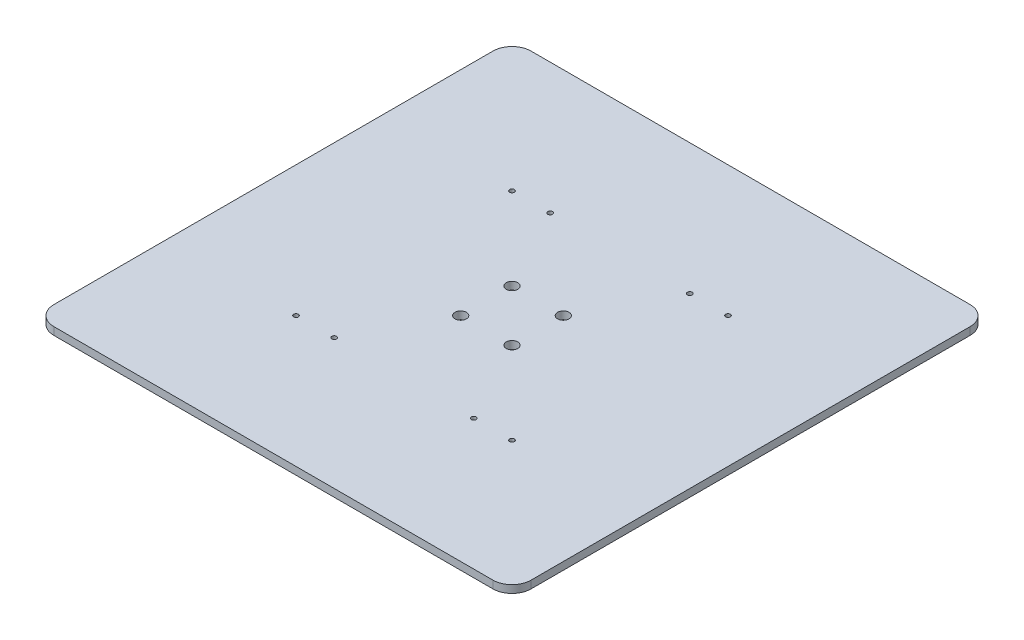
from build123d import *

# Parameters (mm, degrees)
SKETCH_1_W               = 250
SKETCH_1_H               = 250
EXTRUDE_1_DEPTH          = 4
FILLET_1_R               = 10
SKETCH_3_R               = 1.25
CUT_EXTRUDE_4_DEPTH      = 177.821944339
PATTERN_CIRCULAR_2_COUNT = 4
SKETCH_7_R               = 1.25
CUT_EXTRUDE_11_DEPTH     = 10
SKETCH_9_R               = 3
CUT_EXTRUDE_12_DEPTH     = 10


with BuildPart() as part:
    # 草图1 → 凸台-拉伸1 (new body)
    with BuildSketch(Plane(origin=(0, 0, 0), x_dir=(1, 0, 0), z_dir=(0, 1, 0))):
        Rectangle(SKETCH_1_W, SKETCH_1_H)
    extrude(amount=EXTRUDE_1_DEPTH)

    # 圆角1
    fillet_1_edges = [part.edges().sort_by_distance(p)[0] for p in [
        (125, 2, 125),
        (-125, 2, 125),
        (-125, 2, -125),
        (125, 2, -125),
    ]]
    fillet(fillet_1_edges, radius=FILLET_1_R)

    # 草图3 → 切除-拉伸4 (cut, through all)
    with BuildSketch(Plane.XZ):
        with Locations(Location((56.568542495, 56.568542495, 0), (0, 0, 270))):
            Circle(SKETCH_3_R)
    cut_extrude_4 = extrude(amount=-CUT_EXTRUDE_4_DEPTH, mode=Mode.SUBTRACT)

    # 阵列(圆周)2: 切除-拉伸4 ×4 about axis
    pattern_circular_2_axis = Axis((-0.004449343, 0, -0.004449343), (0, 1, 0))
    for i in range(1, PATTERN_CIRCULAR_2_COUNT):
        add(cut_extrude_4.rotate(pattern_circular_2_axis, i * 360 / PATTERN_CIRCULAR_2_COUNT), mode=Mode.SUBTRACT)

    # 草图7 → 切除-拉伸11 (cut)
    with BuildSketch(Plane.XZ):
        with Locations(Location((-36.577441182, -56.577441182, 0), (0, 0, 270))):
            Circle(SKETCH_7_R)
        with Locations(Location((36.568542495, -56.577441182, 0), (0, 0, 270))):
            Circle(SKETCH_7_R)
        with Locations(Location((-36.577441182, 56.568542495, 0), (0, 0, 270))):
            Circle(SKETCH_7_R)
        with Locations(Location((36.568542495, 56.568542495, 0), (0, 0, 270))):
            Circle(SKETCH_7_R)
    extrude(amount=-CUT_EXTRUDE_11_DEPTH, mode=Mode.SUBTRACT)

    # 草图9 → 切除-拉伸12 (cut)
    with BuildSketch(Plane.XZ):
        with Locations(Location((13.435028843, 13.435028843, 0), (0, 0, 270))):
            Circle(SKETCH_9_R)
        with Locations(Location((13.435028843, -13.435028843, 0), (0, 0, 270))):
            Circle(SKETCH_9_R)
        with Locations(Location((-13.435028843, -13.435028843, 0), (0, 0, 270))):
            Circle(SKETCH_9_R)
        with Locations(Location((-13.435028843, 13.435028843, 0), (0, 0, 270))):
            Circle(SKETCH_9_R)
    extrude(amount=-CUT_EXTRUDE_12_DEPTH, mode=Mode.SUBTRACT)


solid = part.part
